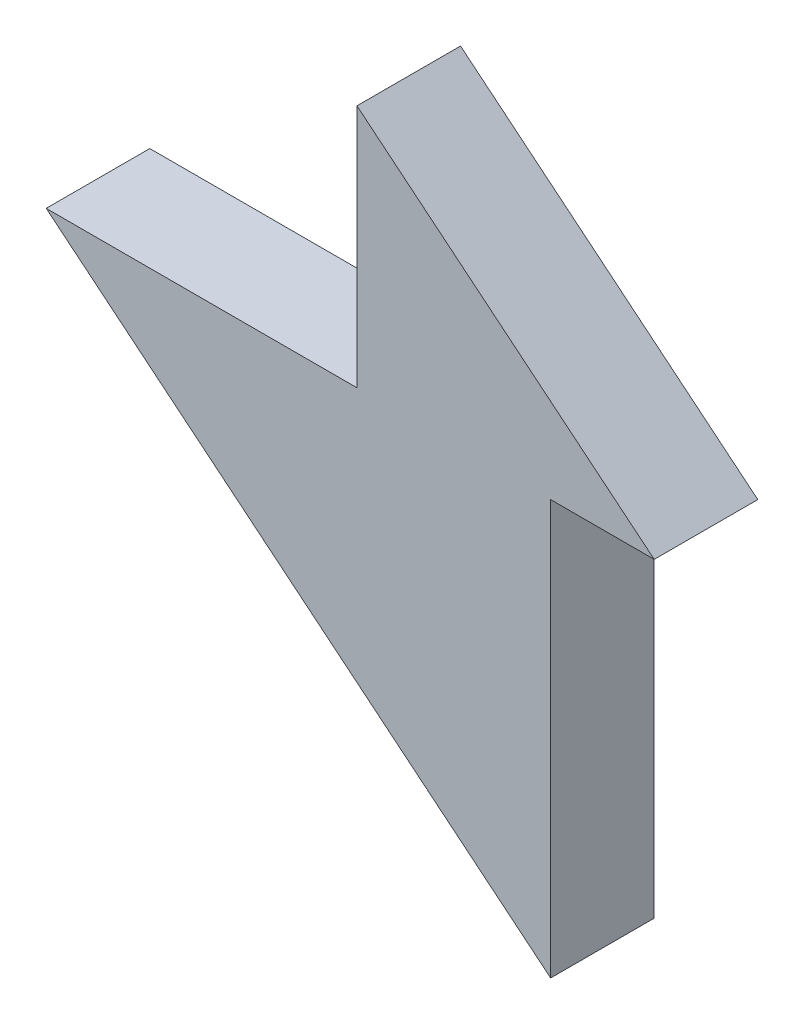
from build123d import *

# Parameters (mm, degrees)
BOSS_EXTRUDE1_DEPTH = 6.35


with BuildPart() as part:
    # Sketch1 → Boss-Extrude1 (new body)
    with BuildSketch(Plane.XY):
        Polygon((0, -10.4), (-30.925, 15), (-11.875, 15), (-11.875, 29.968957154), (6.35, 15), (0, 15), align=None)
    extrude(amount=-BOSS_EXTRUDE1_DEPTH)


solid = part.part
